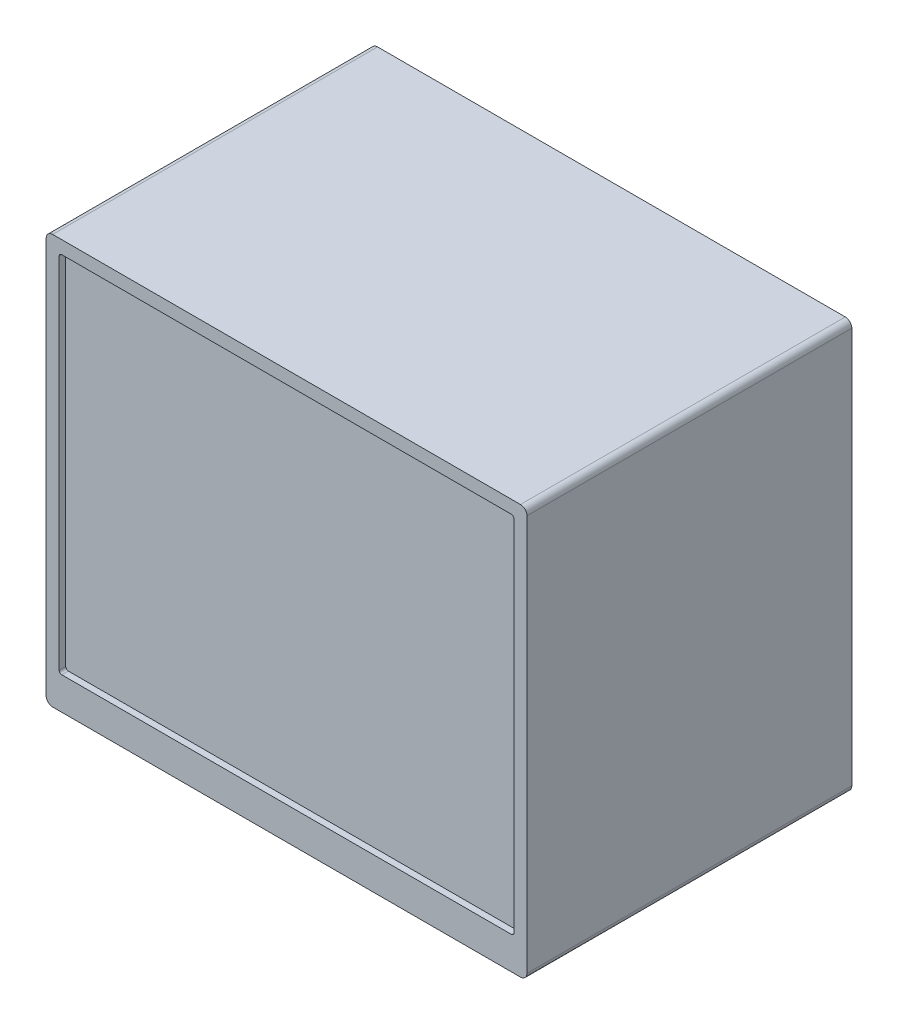
from build123d import *

# Parameters (mm, degrees)
SKETCH1_W           = 370
SKETCH1_H           = 315
BOSS_EXTRUDE1_DEPTH = 250
FILLET2_R           = 5
SKETCH3_W           = 350
SKETCH3_H           = 280
CUT_EXTRUDE1_DEPTH  = 5
FILLET3_R           = 2
SCALE3_SCALE        = 0.3


with BuildPart() as part:
    # Sketch1 → Boss-Extrude1 (new body)
    with BuildSketch(Plane.XY):
        with Locations((7.880798198, -42.761829759)):
            Rectangle(SKETCH1_W, SKETCH1_H)
    extrude(amount=BOSS_EXTRUDE1_DEPTH)

    # Fillet2
    fillet2_edges = [part.edges().sort_by_distance(p)[0] for p in [
        (-177.119201802, 114.738170241, 125),
        (192.880798198, 114.738170241, 125),
        (192.880798198, -200.261829759, 125),
        (-177.119201802, -200.261829759, 125),
    ]]
    fillet(fillet2_edges, radius=FILLET2_R)

    # Sketch3 → Cut-Extrude1 (cut)
    with BuildSketch(Plane.XY.offset(250)):
        with Locations((7.880798198, -35.261829759)):
            Rectangle(SKETCH3_W, SKETCH3_H)
    extrude(amount=-CUT_EXTRUDE1_DEPTH, mode=Mode.SUBTRACT)

    # Fillet3
    fillet3_edges = [part.edges().sort_by_distance(p)[0] for p in [
        (-167.119201802, -175.261829759, 247.5),
        (-167.119201802, 104.738170241, 247.5),
        (182.880798198, 104.738170241, 247.5),
        (182.880798198, -175.261829759, 247.5),
    ]]
    fillet(fillet3_edges, radius=FILLET3_R)


with BuildPart() as part_1:
    # Scale3: scaled about (7.880798198, -42.890132661, 122.904385933)
    add(part.part.scale(SCALE3_SCALE).moved(Location((5.516558739, -30.023092863, 86.033070153))))


solid = part_1.part
